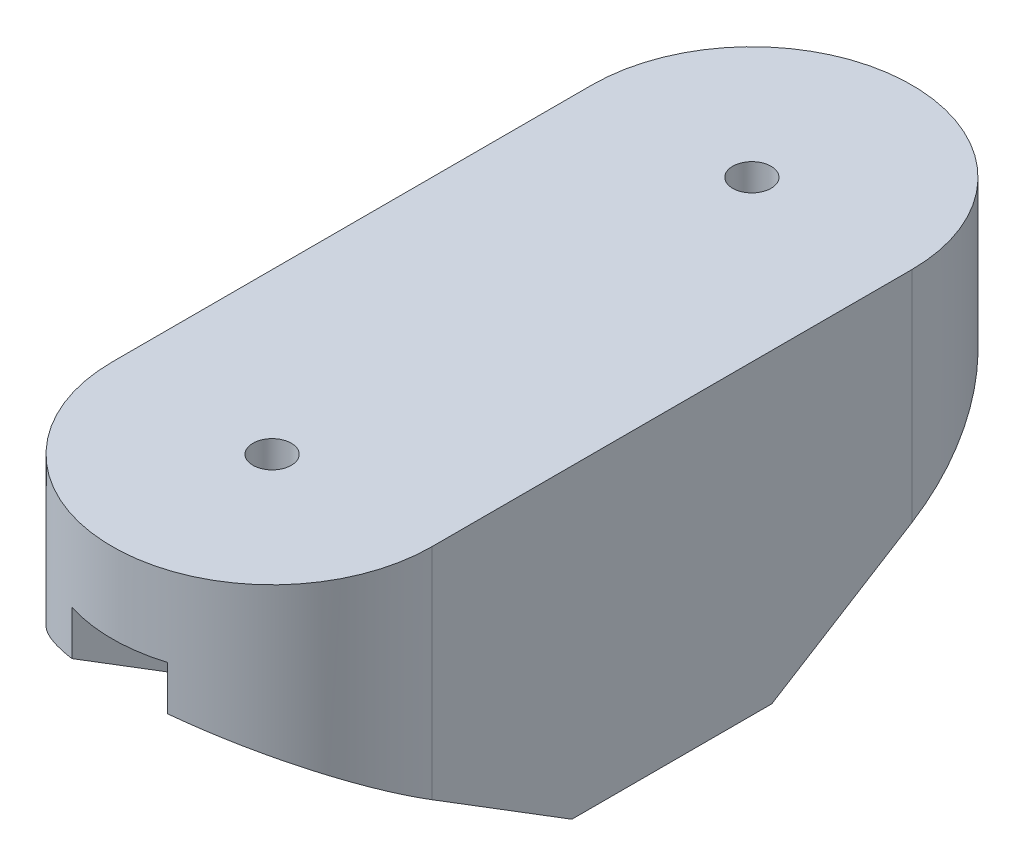
from build123d import *

# Parameters (mm, degrees)
BOSS_EXTRUDE1_DEPTH      = 6.35
BOSS_EXTRUDE3_DEPTH      = 12.7
BOSS_EXTRUDE3_DEPTH_BACK = 12.7
CUT_EXTRUDE13_DEPTH      = 58.729461394
CUT_EXTRUDE13_DEPTH_BACK = 58.729461394
SKETCH11_W               = 7.59470995
SKETCH11_H               = 29.201393096
CUT_EXTRUDE19_DEPTH      = 56.356413171
CUT_EXTRUDE20_DEPTH      = 1.778
SKETCH17_R               = 1.524
CUT_EXTRUDE21_DEPTH      = 56.958411062


with BuildPart() as part:
    # Sketch1 → Boss-Extrude1 (new body)
    with BuildSketch(Plane(origin=(0, 0, 0), x_dir=(1, 0, 0), z_dir=(0, 1, 0))):
        with BuildLine():
            Line((12.7, 0), (12.7, -38.1))
            ThreePointArc((12.7, -38.1), (0, -50.8), (-12.7, -38.1))
            Line((-12.7, -38.1), (-12.7, 0))
            ThreePointArc((-12.7, 0), (0, 12.7), (12.7, 0))
        make_face()
    extrude(amount=-BOSS_EXTRUDE1_DEPTH)

    # Sketch2 → Boss-Extrude3 (add, two sides: drawn at the far end of the back side and taken through both)
    with BuildSketch(Plane(origin=(0, 0, 0), x_dir=(0, 0, -1), z_dir=(1, 0, 0)).offset(-BOSS_EXTRUDE3_DEPTH_BACK)):
        Polygon((-50.8, -6.35), (12.7, -6.35), (12.7, -9.525), (-11.11884122, -24.305569585), (-26.99384122, -24.305569585), (-50.8, -9.525), align=None)
    extrude(amount=BOSS_EXTRUDE3_DEPTH + BOSS_EXTRUDE3_DEPTH_BACK)

    # Sketch11 → Cut-Extrude13 (cut, two sides: drawn at the far end of the back side and taken through both)
    with BuildSketch(Plane.XY.offset(-CUT_EXTRUDE13_DEPTH_BACK)):
        with Locations((0.012645025, -20.950696548)):
            Rectangle(SKETCH11_W, SKETCH11_H)
    extrude(amount=CUT_EXTRUDE13_DEPTH + CUT_EXTRUDE13_DEPTH_BACK, mode=Mode.SUBTRACT)

    # Sketch10 → Cut-Extrude19 (cut, through all)
    with BuildSketch(Plane(origin=(0, -6.35, 0), x_dir=(1, 0, 0), z_dir=(0, 1, 0))):
        with BuildLine():
            ThreePointArc((0, 12.7), (8.980256121, 8.980256121), (12.7, 0))
            Line((12.7, 0), (12.7, 12.7))
            Line((12.7, 12.7), (0, 12.7))
        make_face()
        with BuildLine():
            Line((12.7, -50.8), (12.7, -38.1))
            ThreePointArc((12.7, -38.1), (8.980256121, -47.080256121), (0, -50.8))
            Line((0, -50.8), (12.7, -50.8))
        make_face()
        with BuildLine():
            ThreePointArc((-12.7, 0), (-8.980256121, 8.980256121), (0, 12.7))
            Line((0, 12.7), (-12.7, 12.7))
            Line((-12.7, 12.7), (-12.7, 0))
        make_face()
        with BuildLine():
            Line((-12.7, -50.8), (0, -50.8))
            ThreePointArc((0, -50.8), (-8.980256121, -47.080256121), (-12.7, -38.1))
            Line((-12.7, -38.1), (-12.7, -50.8))
        make_face()
    extrude(amount=-CUT_EXTRUDE19_DEPTH, mode=Mode.SUBTRACT)

    # Sketch16 → Cut-Extrude20 (cut)
    with BuildSketch(Plane.XZ.offset(6.35)):
        Polygon((0, 2.504895139), (-2.169302824, 1.252447569), (-2.169302824, -1.252447569), (0, -2.504895139), (2.169302824, -1.252447569), (2.169302824, 1.252447569), align=None)
        Polygon((0, 40.493188159), (-2.169302824, 39.24074059), (-2.169302824, 36.735845451), (0, 35.483397882), (2.169302824, 36.735845451), (2.169302824, 39.24074059), align=None)
    extrude(amount=-CUT_EXTRUDE20_DEPTH, mode=Mode.SUBTRACT)

    # Sketch17 → Cut-Extrude21 (cut, through all)
    with BuildSketch(Plane.XZ.offset(4.572)):
        with Locations(Location((0, 38.1, 0), (0, 0, 270))):
            Circle(SKETCH17_R)
        with Locations(Location((0, 0, 0), (0, 0, 270))):
            Circle(SKETCH17_R)
    extrude(amount=-CUT_EXTRUDE21_DEPTH, mode=Mode.SUBTRACT)


solid = part.part
